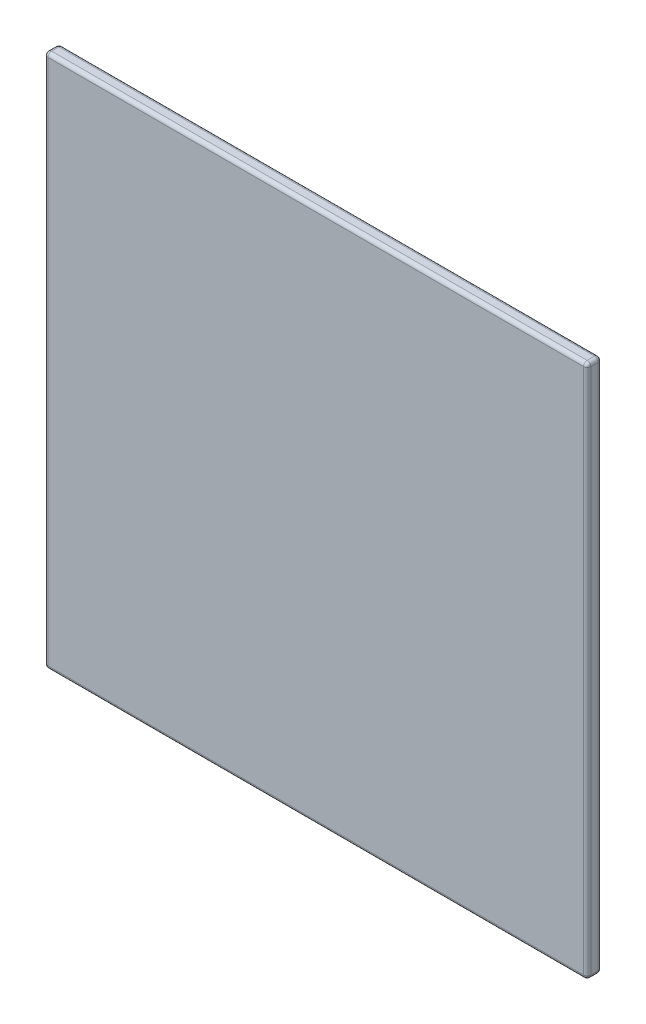
from build123d import *

# Parameters (mm, degrees)
SKETCH1_W           = 74.7
SKETCH1_H           = 73.5
BOSS_EXTRUDE1_DEPTH = 2
FILLET1_R           = 0.5


with BuildPart() as part:
    # Sketch1 → Boss-Extrude1 (new body)
    with BuildSketch(Plane.XY):
        Rectangle(SKETCH1_W, SKETCH1_H)
    extrude(amount=BOSS_EXTRUDE1_DEPTH)

    # Fillet1
    fillet1_edges = [part.edges().sort_by_distance(p)[0] for p in [
        (-37.35, 0, 2),
        (0, -36.75, 2),
        (37.35, 0, 2),
        (0, -36.75, 0),
        (-37.35, 0, 0),
        (0, 36.75, 0),
        (37.35, 0, 0),
        (37.35, -36.75, 1),
        (-37.35, -36.75, 1),
        (-37.35, 36.75, 1),
        (37.35, 36.75, 1),
        (0, 36.75, 2),
    ]]
    fillet(fillet1_edges, radius=FILLET1_R)


solid = part.part
